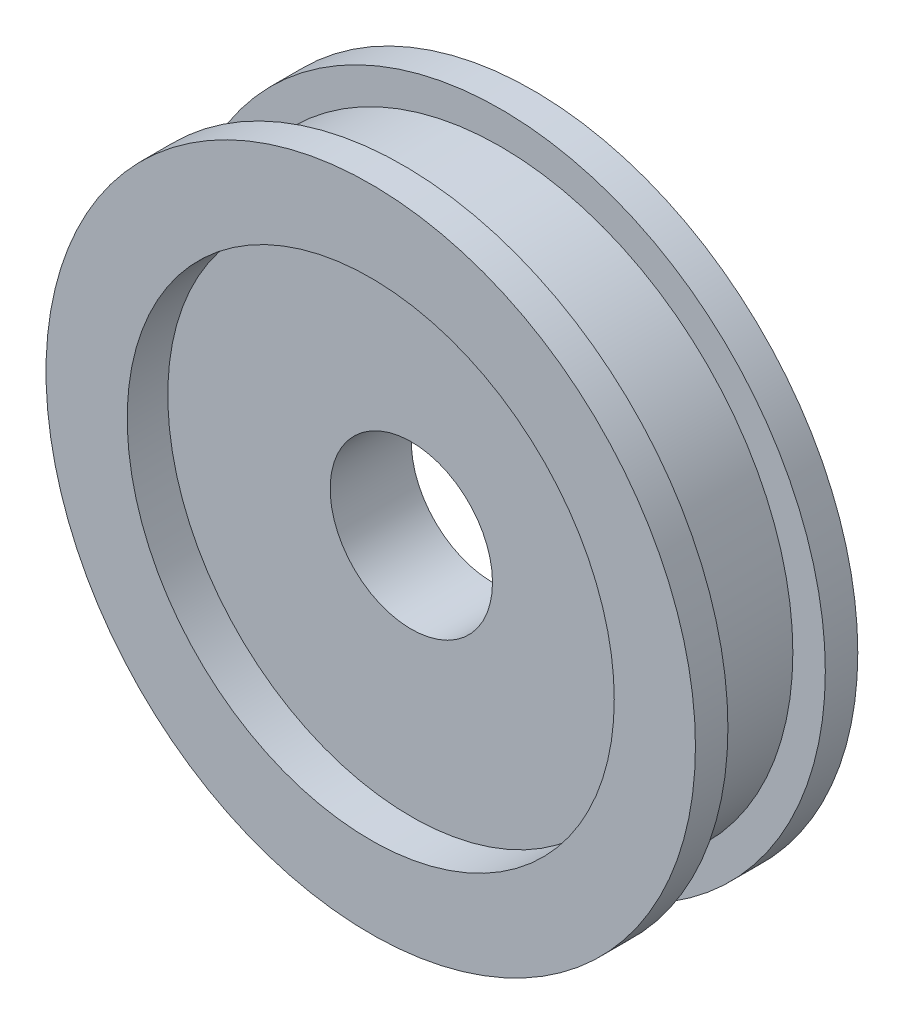
from build123d import *

# Parameters (mm, degrees)
SKETCH_1_R          = 20
SKETCH_1_R_2        = 15
SKETCH_1_R_3        = 5
EXTRUDE_2_DEPTH     = 5
SKETCH_2_R          = 15
CUT_EXTRUDE_1_DEPTH = 5
SKETCH_3_R          = 15
CUT_EXTRUDE_6_DEPTH = 31
SKETCH_4_R          = 15
EXTRUDE_3_DEPTH     = 2.5
SKETCH_5_R          = 5
CUT_EXTRUDE_7_DEPTH = 30.261749777
SKETCH_8_W          = 2
SKETCH_8_H          = 6


with BuildPart() as part:
    # 草图1 → 凸台-拉伸2 (new, symmetric)
    # profile 1 of 2: a face of its own
    with BuildSketch(Plane.XY):
        Circle(SKETCH_1_R)
        Circle(SKETCH_1_R_2, mode=Mode.SUBTRACT)
    # profile 2 of 2: a face of its own
    with BuildSketch(Plane.XY):
        Circle(SKETCH_1_R_2)
        Circle(SKETCH_1_R_3, mode=Mode.SUBTRACT)
    extrude(amount=EXTRUDE_2_DEPTH, both=True)

    # 草图2 → 切除-拉伸1 (cut)
    with BuildSketch(Plane.XY.offset(5)):
        Circle(SKETCH_2_R)
    extrude(amount=-CUT_EXTRUDE_1_DEPTH, mode=Mode.SUBTRACT)

    # 草图3 → 切除-拉伸6 (cut, through all)
    with BuildSketch(Plane(origin=(0, 0, -5), x_dir=(-1, 0, 0), z_dir=(0, 0, -1))):
        with Locations(Location((0, 0, 0), (0, 0, 180))):
            Circle(SKETCH_3_R)
    extrude(amount=-CUT_EXTRUDE_6_DEPTH, mode=Mode.SUBTRACT)

    # 草图4 → 凸台-拉伸3 (add, symmetric)
    with BuildSketch(Plane.XY):
        Circle(SKETCH_4_R)
    extrude(amount=EXTRUDE_3_DEPTH, both=True)

    # 草图5 → 切除-拉伸7 (cut, through all)
    with BuildSketch(Plane.XY.offset(2.5)):
        Circle(SKETCH_5_R)
    extrude(amount=-CUT_EXTRUDE_7_DEPTH, mode=Mode.SUBTRACT)

    # 草图8 → 切除-旋转1 (revolve, cut)
    with BuildSketch(Plane(origin=(0, 0, 0), x_dir=(1, 0, 0), z_dir=(0, 1, 0)), mode=Mode.PRIVATE) as cut_revolve_1_sk:
        with Locations((-19, 0)):
            Rectangle(SKETCH_8_W, SKETCH_8_H)
    revolve(cut_revolve_1_sk.sketch.rotate(Axis((0, 0, 0), (0, 0, -1)), 180), axis=Axis((0, 0, 0), (0, 0, -1)), mode=Mode.SUBTRACT)


solid = part.part
